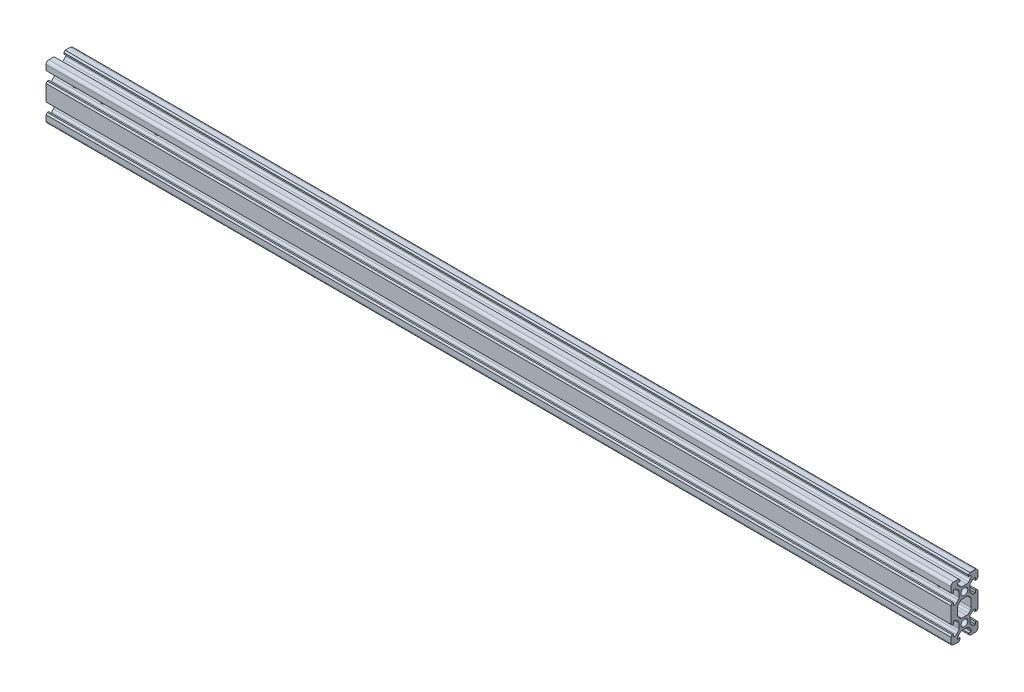
from build123d import *

# Parameters (mm, degrees)
SKETCH1_R           = 2.5
BOSS_EXTRUDE1_DEPTH = 666
SKETCH2_R           = 2.4
CUT_EXTRUDE1_DEPTH  = 668.499812734


with BuildPart() as part:
    # Sketch1 → Boss-Extrude1 (new body)
    with BuildSketch(Plane(origin=(0, 0, 0), x_dir=(0, 0, -1), z_dir=(1, 0, 0))):
        with BuildLine():
            Line((6.9, 38), (5, 38))
            Line((5, 38), (5, 37.242640687))
            ThreePointArc((5, 37.242640687), (5.152240935, 36.477273822), (5.585786438, 35.828427125))
            Line((5.585786438, 35.828427125), (6.876358939, 34.537854624))
            ThreePointArc((6.876358939, 34.537854624), (7.525205636, 34.104309121), (8.290572501, 33.952068186))
            Line((8.290572501, 33.952068186), (11.709427499, 33.952068186))
            ThreePointArc((11.709427499, 33.952068186), (12.474794364, 34.104309121), (13.123641061, 34.537854624))
            Line((13.123641061, 34.537854624), (14.414213562, 35.828427125))
            ThreePointArc((14.414213562, 35.828427125), (14.847759065, 36.477273822), (15, 37.242640687))
            Line((15, 37.242640687), (15, 38))
            Line((15, 38), (13.1, 38))
            Line((13.1, 38), (13.1, 39))
            Line((13.1, 39), (14.1, 40))
            Line((14.1, 40), (18, 40))
            ThreePointArc((18, 40), (19.414213562, 39.414213562), (20, 38))
            Line((20, 38), (20, 34.1))
            Line((20, 34.1), (19, 33.1))
            Line((19, 33.1), (18, 33.1))
            Line((18, 33.1), (18, 35))
            Line((18, 35), (17.242640687, 35))
            ThreePointArc((17.242640687, 35), (16.477273822, 34.847759065), (15.828427125, 34.414213562))
            Line((15.828427125, 34.414213562), (14.537854624, 33.123641061))
            ThreePointArc((14.537854624, 33.123641061), (14.104309121, 32.474794364), (13.952068186, 31.709427499))
            Line((13.952068186, 31.709427499), (13.952068186, 28.290572501))
            ThreePointArc((13.952068186, 28.290572501), (14.104309121, 27.525205636), (14.537854624, 26.876358939))
            Line((14.537854624, 26.876358939), (15.828427125, 25.585786438))
            ThreePointArc((15.828427125, 25.585786438), (16.477273822, 25.152240935), (17.242640687, 25))
            Line((17.242640687, 25), (18, 25))
            Line((18, 25), (18, 26.9))
            Line((18, 26.9), (19, 26.9))
            Line((19, 26.9), (20, 25.9))
            Line((20, 25.9), (20, 14.1))
            Line((20, 14.1), (19, 13.1))
            Line((19, 13.1), (18, 13.1))
            Line((18, 13.1), (18, 15))
            Line((18, 15), (17.242640687, 15))
            ThreePointArc((17.242640687, 15), (16.477273822, 14.847759065), (15.828427125, 14.414213562))
            Line((15.828427125, 14.414213562), (14.537854624, 13.123641061))
            ThreePointArc((14.537854624, 13.123641061), (14.104309121, 12.474794364), (13.952068186, 11.709427499))
            Line((13.952068186, 11.709427499), (13.952068186, 8.290572501))
            ThreePointArc((13.952068186, 8.290572501), (14.104309121, 7.525205636), (14.537854624, 6.876358939))
            Line((14.537854624, 6.876358939), (15.828427125, 5.585786438))
            ThreePointArc((15.828427125, 5.585786438), (16.477273822, 5.152240935), (17.242640687, 5))
            Line((17.242640687, 5), (18, 5))
            Line((18, 5), (18, 6.9))
            Line((18, 6.9), (19, 6.9))
            Line((19, 6.9), (20, 5.9))
            Line((20, 5.9), (20, 2))
            ThreePointArc((20, 2), (19.414213562, 0.585786438), (18, 0))
            Line((18, 0), (14.1, 0))
            Line((14.1, 0), (13.1, 1))
            Line((13.1, 1), (13.1, 2))
            Line((13.1, 2), (15, 2))
            Line((15, 2), (15, 2.757359313))
            ThreePointArc((15, 2.757359313), (14.847759065, 3.522726178), (14.414213562, 4.171572875))
            Line((14.414213562, 4.171572875), (13.123641061, 5.462145376))
            ThreePointArc((13.123641061, 5.462145376), (12.474794364, 5.895690879), (11.709427499, 6.047931814))
            Line((11.709427499, 6.047931814), (8.290572501, 6.047931814))
            ThreePointArc((8.290572501, 6.047931814), (7.525205636, 5.895690879), (6.876358939, 5.462145376))
            Line((6.876358939, 5.462145376), (5.585786438, 4.171572875))
            ThreePointArc((5.585786438, 4.171572875), (5.152240935, 3.522726178), (5, 2.757359313))
            Line((5, 2.757359313), (5, 2))
            Line((5, 2), (6.9, 2))
            Line((6.9, 2), (6.9, 1))
            Line((6.9, 1), (5.9, 0))
            Line((5.9, 0), (2, 0))
            ThreePointArc((2, 0), (0.585786438, 0.585786438), (0, 2))
            Line((0, 2), (0, 5.9))
            Line((0, 5.9), (1, 6.9))
            Line((1, 6.9), (2, 6.9))
            Line((2, 6.9), (2, 5))
            Line((2, 5), (2.757359313, 5))
            ThreePointArc((2.757359313, 5), (3.522726178, 5.152240935), (4.171572875, 5.585786438))
            Line((4.171572875, 5.585786438), (5.462145376, 6.876358939))
            ThreePointArc((5.462145376, 6.876358939), (5.895690879, 7.525205636), (6.047931814, 8.290572501))
            Line((6.047931814, 8.290572501), (6.047931814, 11.709427499))
            ThreePointArc((6.047931814, 11.709427499), (5.895690879, 12.474794364), (5.462145376, 13.123641061))
            Line((5.462145376, 13.123641061), (4.171572875, 14.414213562))
            ThreePointArc((4.171572875, 14.414213562), (3.522726178, 14.847759065), (2.757359313, 15))
            Line((2.757359313, 15), (2, 15))
            Line((2, 15), (2, 13.1))
            Line((2, 13.1), (1, 13.1))
            Line((1, 13.1), (0, 14.1))
            Line((0, 14.1), (0, 25.9))
            Line((0, 25.9), (1, 26.9))
            Line((1, 26.9), (2, 26.9))
            Line((2, 26.9), (2, 25))
            Line((2, 25), (2.757359313, 25))
            ThreePointArc((2.757359313, 25), (3.522726178, 25.152240935), (4.171572875, 25.585786438))
            Line((4.171572875, 25.585786438), (5.462145376, 26.876358939))
            ThreePointArc((5.462145376, 26.876358939), (5.895690879, 27.525205636), (6.047931814, 28.290572501))
            Line((6.047931814, 28.290572501), (6.047931814, 31.709427499))
            ThreePointArc((6.047931814, 31.709427499), (5.895690879, 32.474794364), (5.462145376, 33.123641061))
            Line((5.462145376, 33.123641061), (4.171572875, 34.414213562))
            ThreePointArc((4.171572875, 34.414213562), (3.522726178, 34.847759065), (2.757359313, 35))
            Line((2.757359313, 35), (2, 35))
            Line((2, 35), (2, 33.1))
            Line((2, 33.1), (1, 33.1))
            Line((1, 33.1), (0, 34.1))
            Line((0, 34.1), (0, 38))
            ThreePointArc((0, 38), (0.585786438, 39.414213562), (2, 40))
            Line((2, 40), (5.9, 40))
            Line((5.9, 40), (6.9, 39))
            Line((6.9, 39), (6.9, 38))
        make_face()
        with Locations((10, 10)):
            Circle(SKETCH1_R, mode=Mode.SUBTRACT)
        with Locations((10, 30)):
            Circle(SKETCH1_R, mode=Mode.SUBTRACT)
        with BuildLine():
            Line((14.414213562, 15.828427125), (13.123641061, 14.537854624))
            ThreePointArc((13.123641061, 14.537854624), (12.474794364, 14.104309121), (11.709427499, 13.952068186))
            Line((11.709427499, 13.952068186), (8.290572501, 13.952068186))
            ThreePointArc((8.290572501, 13.952068186), (7.525205636, 14.104309121), (6.876358939, 14.537854624))
            Line((6.876358939, 14.537854624), (5.585786438, 15.828427125))
            ThreePointArc((5.585786438, 15.828427125), (5.152240935, 16.477273822), (5, 17.242640687))
            Line((5, 17.242640687), (5, 22.757359313))
            ThreePointArc((5, 22.757359313), (5.152240935, 23.522726178), (5.585786438, 24.171572875))
            Line((5.585786438, 24.171572875), (6.876358939, 25.462145376))
            ThreePointArc((6.876358939, 25.462145376), (7.525205636, 25.895690879), (8.290572501, 26.047931814))
            Line((8.290572501, 26.047931814), (11.709427499, 26.047931814))
            ThreePointArc((11.709427499, 26.047931814), (12.474794364, 25.895690879), (13.123641061, 25.462145376))
            Line((13.123641061, 25.462145376), (14.414213562, 24.171572875))
            ThreePointArc((14.414213562, 24.171572875), (14.847759065, 23.522726178), (15, 22.757359313))
            Line((15, 22.757359313), (15, 17.242640687))
            ThreePointArc((15, 17.242640687), (14.847759065, 16.477273822), (14.414213562, 15.828427125))
        make_face(mode=Mode.SUBTRACT)
    extrude(amount=BOSS_EXTRUDE1_DEPTH)

    # Sketch2 → Cut-Extrude1 (cut, through all)
    with BuildSketch(Plane.XY):
        with Locations((15, 30)):
            Circle(SKETCH2_R)
        with Locations((35, 30)):
            Circle(SKETCH2_R)
        with Locations((75, 30)):
            Circle(SKETCH2_R)
        with Locations((591, 30)):
            Circle(SKETCH2_R)
        with Locations((631, 30)):
            Circle(SKETCH2_R)
        with Locations((651, 30)):
            Circle(SKETCH2_R)
    extrude(amount=-CUT_EXTRUDE1_DEPTH, mode=Mode.SUBTRACT)


solid = part.part
